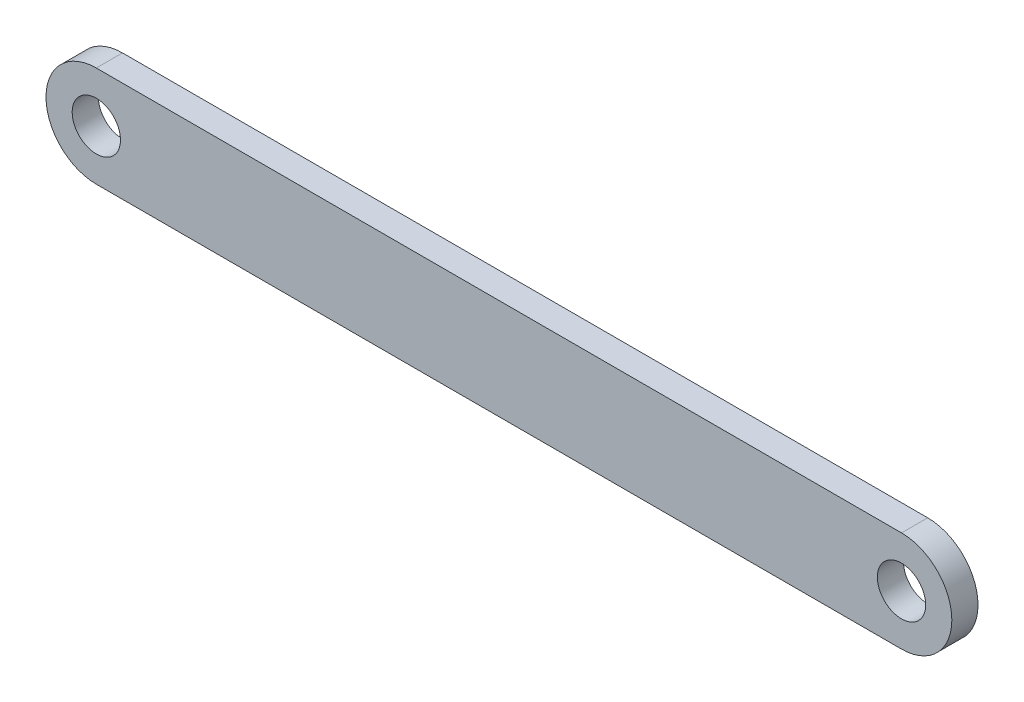
from build123d import *

# Parameters (mm, degrees)
SKETCH1_R           = 6
BOSS_EXTRUDE1_DEPTH = 3.25


with BuildPart() as part:
    # Sketch1 → Boss-Extrude1 (new, symmetric)
    with BuildSketch(Plane.XY):
        with BuildLine():
            Line((0, 12.5), (200, 12.5))
            ThreePointArc((200, 12.5), (212.5, 0), (200, -12.5))
            Line((200, -12.5), (0, -12.5))
            ThreePointArc((0, -12.5), (-12.5, 0), (0, 12.5))
        make_face()
        with Locations(Location((0, 0, 0), (0, 0, 180))):
            Circle(SKETCH1_R, mode=Mode.SUBTRACT)
        with Locations(Location((200, 0, 0), (0, 0, 180))):
            Circle(SKETCH1_R, mode=Mode.SUBTRACT)
    extrude(amount=BOSS_EXTRUDE1_DEPTH, both=True)


solid = part.part
